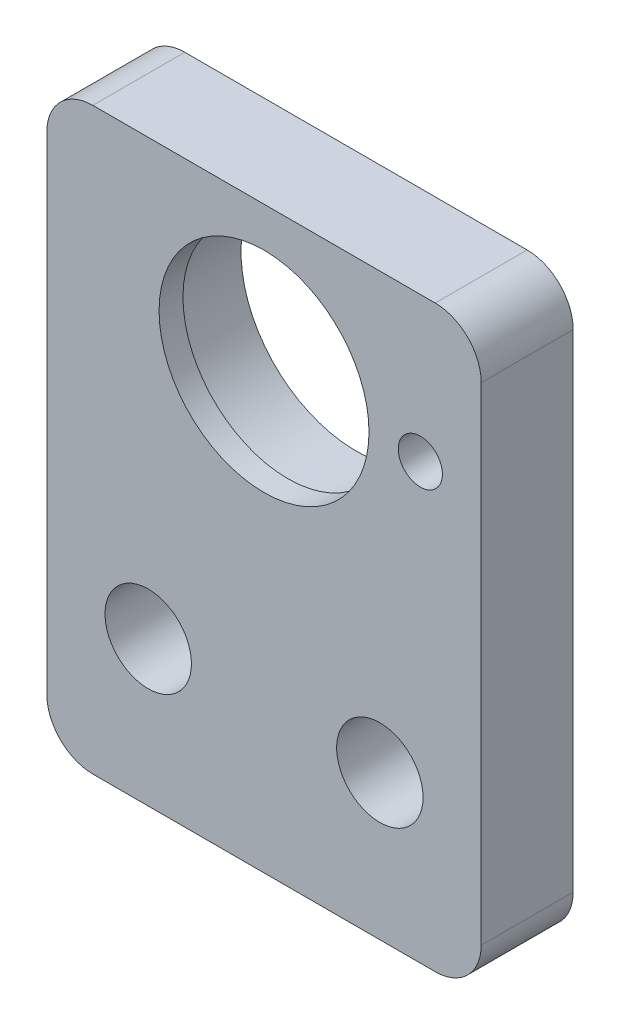
from build123d import *

# Parameters (mm, degrees)
SKETCH1_R           = 2.9845
SKETCH1_R_2         = 1.524
SKETCH1_R_3         = 7.250000001
BOSS_EXTRUDE1_DEPTH = 6.35
SKETCH1_3_R         = 7.9375
SKETCH1_3_R_2       = 7.250000001
CUT_EXTRUDE1_DEPTH  = 4.699


with BuildPart() as part:
    # Sketch1 → Boss-Extrude1 (new body)
    with BuildSketch(Plane.XY):
        with BuildLine():
            ThreePointArc((131.166701588, 209.033854223), (128.921637558, 208.103918253), (127.991701588, 205.858854223))
            Line((127.991701588, 205.858854223), (127.991701588, 172.208854223))
            ThreePointArc((127.991701588, 172.208854223), (128.921637558, 169.963790192), (131.166701588, 169.033854223))
            Line((131.166701588, 169.033854223), (154.816701588, 169.033854223))
            ThreePointArc((154.816701588, 169.033854223), (157.061765618, 169.963790192), (157.991701588, 172.208854223))
            Line((157.991701588, 172.208854223), (157.991701588, 205.858854223))
            ThreePointArc((157.991701588, 205.858854223), (157.061765618, 208.103918253), (154.816701588, 209.033854223))
            Line((154.816701588, 209.033854223), (131.166701588, 209.033854223))
        make_face()
        with Locations((134.991701588, 179.033854223)):
            Circle(SKETCH1_R, mode=Mode.SUBTRACT)
        with Locations((150.991701587, 179.033854223)):
            Circle(SKETCH1_R, mode=Mode.SUBTRACT)
        with Locations((153.786701588, 199.033854223)):
            Circle(SKETCH1_R_2, mode=Mode.SUBTRACT)
        with Locations((142.991701588, 199.033854223)):
            Circle(SKETCH1_R_3, mode=Mode.SUBTRACT)
    extrude(amount=BOSS_EXTRUDE1_DEPTH)

    # Sketch1<3> → Cut-Extrude1 (cut)
    with BuildSketch(Plane.XY):
        with Locations((142.991701588, 199.033854223)):
            Circle(SKETCH1_3_R)
        with Locations((142.991701588, 199.033854223)):
            Circle(SKETCH1_3_R_2, mode=Mode.SUBTRACT)
    extrude(amount=CUT_EXTRUDE1_DEPTH, mode=Mode.SUBTRACT)


solid = part.part
